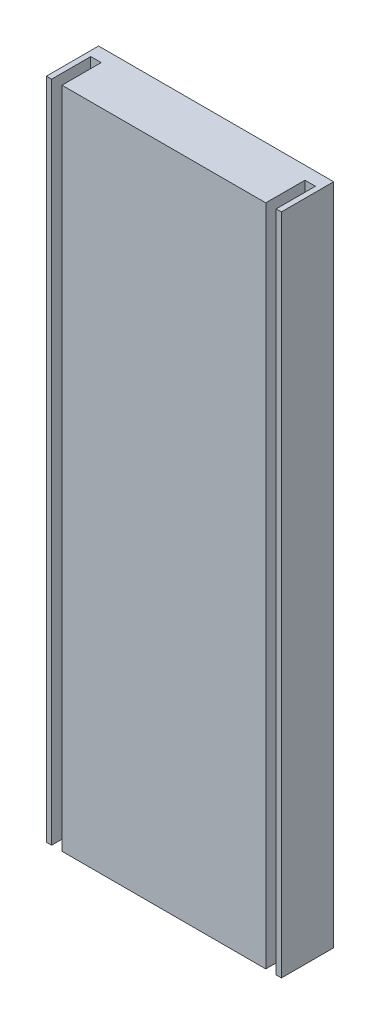
from build123d import *

# Parameters (mm, degrees)
EXTRUDE_1_DEPTH = 254


with BuildPart() as part:
    # Эскиз1 → Бобышка-Вытянуть1 (new body)
    with BuildSketch(Plane(origin=(0, 0, 0), x_dir=(1, 0, 0), z_dir=(0, 1, 0))):
        Polygon((-31.616298812, -7.241086587), (-31.616298812, 7.758913413), (-27.616298812, 7.758913413), (-27.616298812, -7.241086587), (50.383701188, -7.241086587), (50.383701188, 7.758913413), (54.383701188, 7.758913413), (54.383701188, -7.241086587), (56.383701188, -7.241086587), (56.383701188, 12.758913413), (-33.616298812, 12.758913413), (-33.616298812, -7.241086587), align=None)
    extrude(amount=EXTRUDE_1_DEPTH)


solid = part.part
